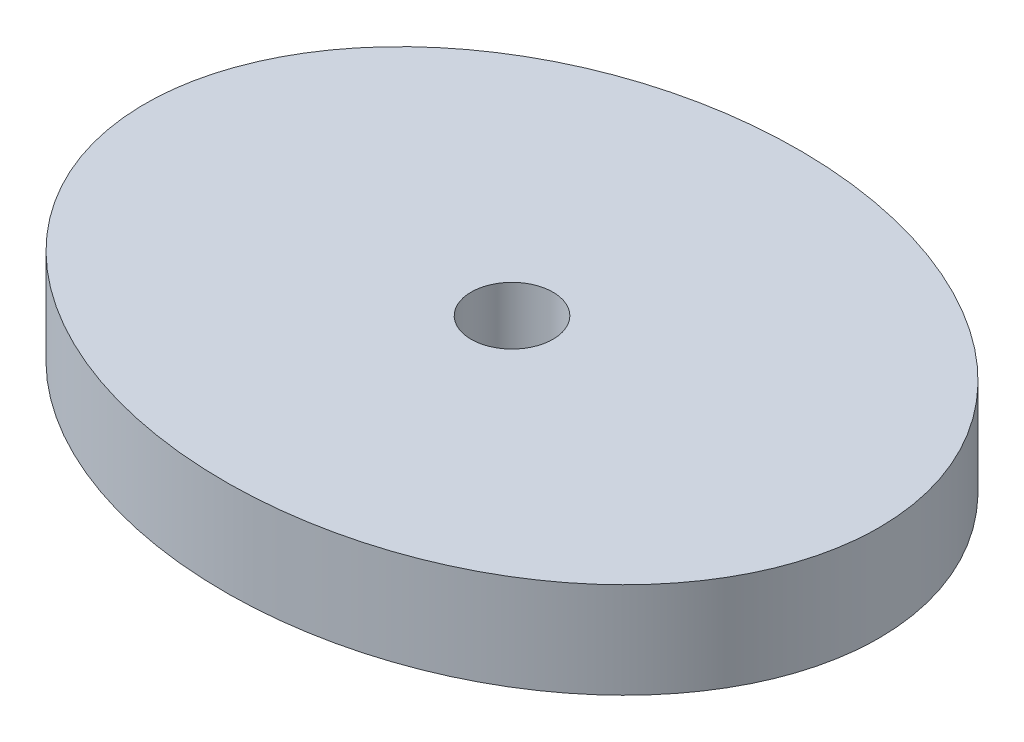
from build123d import *

# Parameters (mm, degrees)
SKETCH1_RX          = 19.175
SKETCH1_RY          = 15
BOSS_EXTRUDE1_DEPTH = 5
SKETCH2_R           = 2.1375
CUT_EXTRUDE1_DEPTH  = 5


with BuildPart() as part:
    # Sketch1 → Boss-Extrude1 (new body)
    with BuildSketch(Plane(origin=(0, 0, 0), x_dir=(1, 0, 0), z_dir=(0, 1, 0))):
        with Locations((0, 0)):
            Ellipse(SKETCH1_RX, SKETCH1_RY)
    extrude(amount=BOSS_EXTRUDE1_DEPTH)

    # Sketch2 → Cut-Extrude1 (cut)
    with BuildSketch(Plane(origin=(0, 5, 0), x_dir=(1, 0, 0), z_dir=(0, 1, 0))):
        with Locations(Location((0, 0, 0), (0, 0, 270))):
            Circle(SKETCH2_R)
    extrude(amount=-CUT_EXTRUDE1_DEPTH, mode=Mode.SUBTRACT)


solid = part.part
